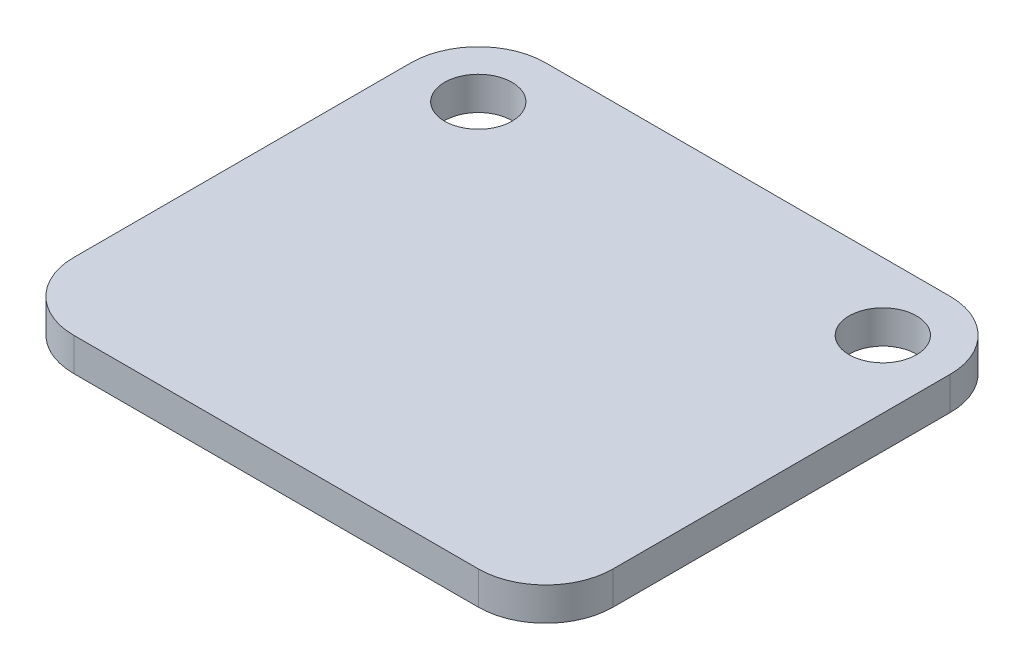
from build123d import *

# Parameters (mm, degrees)
SKETCH1_R           = 1.27
BOSS_EXTRUDE1_DEPTH = 1.25


with BuildPart() as part:
    # Sketch1 → Boss-Extrude1 (new body)
    with BuildSketch(Plane(origin=(0, 0, 0), x_dir=(1, 0, 0), z_dir=(0, 1, 0))):
        with BuildLine():
            ThreePointArc((-7.62, -8.89), (-9.416051224, -8.146051224), (-10.16, -6.35))
            Line((-10.16, -6.35), (-10.16, 6.35))
            ThreePointArc((-10.16, 6.35), (-9.416051224, 8.146051224), (-7.62, 8.89))
            Line((-7.62, 8.89), (7.62, 8.89))
            ThreePointArc((7.62, 8.89), (9.416051224, 8.146051224), (10.16, 6.35))
            Line((10.16, 6.35), (10.16, -6.35))
            ThreePointArc((10.16, -6.35), (9.416051224, -8.146051224), (7.62, -8.89))
            Line((7.62, -8.89), (-7.62, -8.89))
        make_face()
        with Locations(Location((7.62, 6.35, 0), (0, 0, 270))):
            Circle(SKETCH1_R, mode=Mode.SUBTRACT)
        with Locations(Location((-7.62, 6.35, 0), (0, 0, 270))):
            Circle(SKETCH1_R, mode=Mode.SUBTRACT)
    extrude(amount=BOSS_EXTRUDE1_DEPTH)


solid = part.part
